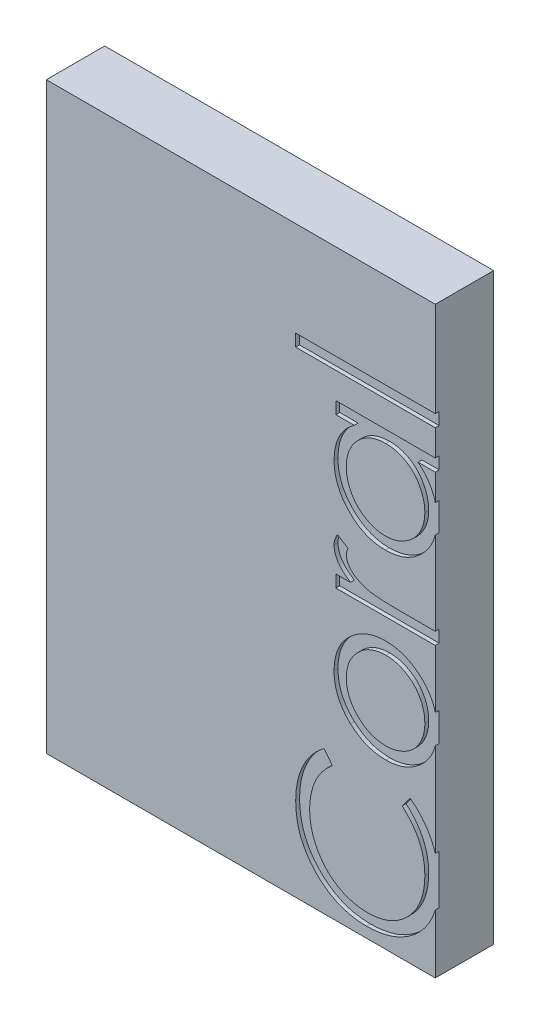
from build123d import *

# Parameters (mm, degrees)
SKETCH1_W           = 10
SKETCH1_H           = 15
BOSS_EXTRUDE1_DEPTH = 1.5
SKETCH2_W           = 3.58974359
SKETCH2_H           = 0.314102564
CUT_EXTRUDE1_DEPTH  = 0.1


with BuildPart() as part:
    # Sketch1 → Boss-Extrude1 (new body)
    with BuildSketch(Plane.XY):
        Rectangle(SKETCH1_W, SKETCH1_H)
    extrude(amount=BOSS_EXTRUDE1_DEPTH)

    # Sketch2 → Cut-Extrude1 (cut)
    # profile 1 of 5: a face of its own
    with BuildSketch(Plane.XY.offset(1.5)):
        with BuildLine():
            Line((2.142227564, -3.820512821), (2.352564103, -4.095352564))
            add(Edge.make_bspline(
                [(2.352564103, -4.095352564), (2.329198442, -4.114958654), (2.28278214, -4.1539065), (2.217598054, -4.216562748), (2.156549782, -4.281875441), (2.09924508, -4.349753703), (2.047987144, -4.421768395), (1.998783962, -4.495175554), (1.955704883, -4.572642388), (1.903078399, -4.679220252), (1.849360057, -4.819185909), (1.803157646, -4.994770751), (1.774023468, -5.17831657), (1.770846635, -5.303509384), (1.769230769, -5.3671875)],
                knots=[0, 0, 0, 0, 0.75789156, 1.505565099, 2.245254514, 2.979266606, 3.711207489, 4.440978832, 5.174393176, 5.91211879, 7.394186119, 8.890401545, 10.418332761, 12, 12, 12, 12], degree=3))
            add(Edge.make_bspline(
                [(1.769230769, -5.3671875), (1.769634732, -5.402270799), (1.770438908, -5.472111792), (1.781048033, -5.575760265), (1.795959243, -5.677473317), (1.818084566, -5.777184783), (1.846057184, -5.874767742), (1.879482602, -5.97086014), (1.920837429, -6.064070756), (1.966545735, -6.155688933), (2.018173011, -6.24346837), (2.074486973, -6.326522597), (2.134853847, -6.404553557), (2.199513113, -6.477605182), (2.268124966, -6.545817673), (2.341458086, -6.608332677), (2.418728518, -6.665985443), (2.500000431, -6.718447395), (2.584516904, -6.765675334), (2.672760474, -6.805386688), (2.763220234, -6.840070315), (2.856537478, -6.867946952), (2.952091972, -6.889840387), (3.050279572, -6.9049765), (3.150914118, -6.915462673), (3.219123313, -6.916263163), (3.253505609, -6.916666667)],
                knots=[0, 0, 0, 0, 1.054877232, 2.099964208, 3.13098259, 4.145888998, 5.169474743, 6.183358035, 7.203388855, 8.234598956, 9.261847606, 10.264062591, 11.251197969, 12.227332808, 13.196685059, 14.158975844, 15.123498106, 16.094582253, 17.066912473, 18.032714859, 19.002806091, 19.979168736, 20.95977404, 21.949109834, 22.966205168, 24, 24, 24, 24], degree=3))
            add(Edge.make_bspline(
                [(3.253505609, -6.916666667), (3.305235776, -6.915401889), (3.406801096, -6.912918666), (3.555588077, -6.890912333), (3.698262935, -6.857202942), (3.833859633, -6.807508901), (3.963508531, -6.74501076), (4.085637373, -6.667030312), (4.202035382, -6.576373468), (4.309883465, -6.472110203), (4.408395797, -6.357701362), (4.495146748, -6.234954252), (4.567461533, -6.104169752), (4.627637506, -5.966793179), (4.673894226, -5.821767049), (4.706458351, -5.669352251), (4.727700531, -5.509880255), (4.72973422, -5.400910855), (4.730769231, -5.345452724)],
                knots=[0, 0, 0, 0, 1.029159485, 2.020618137, 2.987588728, 3.942669054, 4.889339625, 5.846988364, 6.821327795, 7.821533711, 8.827683044, 9.822769455, 10.807800696, 11.797391277, 12.803701919, 13.832062008, 14.896664671, 16, 16, 16, 16], degree=3))
            add(Edge.make_bspline(
                [(4.730769231, -5.345452724), (4.729080451, -5.284350035), (4.725756528, -5.164085326), (4.697597279, -4.9877173), (4.651939362, -4.818881534), (4.588041439, -4.657568948), (4.504976151, -4.504234302), (4.404278274, -4.358637641), (4.284989941, -4.220656071), (4.193906813, -4.137684789), (4.147435897, -4.095352564)],
                knots=[0, 0, 0, 0, 1.028121516, 2.023589091, 2.998037872, 3.967518031, 4.937445131, 5.927275754, 6.942489185, 8, 8, 8, 8], degree=3))
            Line((4.147435897, -4.095352564), (4.355669071, -3.820512821))
            add(Edge.make_bspline(
                [(4.355669071, -3.820512821), (4.384206535, -3.842631706), (4.441144771, -3.886763529), (4.521431128, -3.958210043), (4.596880443, -4.03353031), (4.667115924, -4.112917932), (4.732428286, -4.196512836), (4.792853008, -4.28430735), (4.848069416, -4.376226533), (4.898788398, -4.471540283), (4.943444742, -4.57046823), (4.983016786, -4.672139468), (5.015778067, -4.777177388), (5.043490435, -4.884697801), (5.063250601, -4.99567177), (5.078986048, -5.108809306), (5.088321482, -5.225169334), (5.089265301, -5.303602625), (5.08974359, -5.343349359)],
                knots=[0, 0, 0, 0, 0.986911346, 1.969095443, 2.935967484, 3.900112155, 4.865124501, 5.834589912, 6.812044781, 7.795288262, 8.784678562, 9.777857908, 10.776141921, 11.791195789, 12.811324908, 13.855933174, 14.913475973, 16, 16, 16, 16], degree=3))
            add(Edge.make_bspline(
                [(5.08974359, -5.343349359), (5.089481597, -5.380993026), (5.088963539, -5.455428716), (5.080571372, -5.565327468), (5.069121635, -5.672317049), (5.051881504, -5.776091674), (5.031537164, -5.877217649), (5.004265907, -5.974778234), (4.973716741, -6.069733444), (4.937811754, -6.161701785), (4.897295571, -6.250761485), (4.851504013, -6.336625296), (4.800822148, -6.419253729), (4.746367137, -6.499459149), (4.686389836, -6.576056733), (4.621723201, -6.649710258), (4.55258519, -6.720832735), (4.502730337, -6.76483542), (4.477664263, -6.786959135)],
                knots=[0, 0, 0, 0, 1.114604814, 2.203992996, 3.262667896, 4.300477797, 5.318619304, 6.316056647, 7.298880507, 8.271930387, 9.238335007, 10.195173496, 11.151986948, 12.108099108, 13.064862484, 14.031167946, 15.010108607, 16, 16, 16, 16], degree=3))
            add(Edge.make_bspline(
                [(4.477664263, -6.786959135), (4.434122176, -6.822392467), (4.34756368, -6.892831349), (4.207290924, -6.982991062), (4.060964695, -7.059909976), (3.907737447, -7.122795993), (3.747549613, -7.171099791), (3.580658888, -7.205060501), (3.407398896, -7.226975295), (3.289563768, -7.229490657), (3.229667468, -7.230769231)],
                knots=[0, 0, 0, 0, 0.994611881, 1.977215934, 2.950189954, 3.921972279, 4.908960509, 5.911694611, 6.938501887, 8, 8, 8, 8], degree=3))
            add(Edge.make_bspline(
                [(3.229667468, -7.230769231), (3.166712014, -7.229214037), (3.04285109, -7.226154291), (2.861077137, -7.200158496), (2.686925738, -7.158339699), (2.520721993, -7.098942811), (2.361591713, -7.023637459), (2.210750508, -6.930610846), (2.067233708, -6.820943703), (1.933218957, -6.695496136), (1.810679604, -6.5579288), (1.702873401, -6.410609986), (1.613155885, -6.25382804), (1.538159722, -6.089310188), (1.480515259, -5.915824506), (1.440162072, -5.733741137), (1.415044956, -5.543402222), (1.411869748, -5.413539797), (1.41025641, -5.34755609)],
                knots=[0, 0, 0, 0, 1.032925535, 2.032216505, 3.007276963, 3.968222605, 4.92396291, 5.891752235, 6.871517503, 7.883894988, 8.900124299, 9.891468569, 10.874487609, 11.85992873, 12.854644235, 13.869047385, 14.917252991, 16, 16, 16, 16], degree=3))
            add(Edge.make_bspline(
                [(1.41025641, -5.34755609), (1.410738968, -5.30734175), (1.411694142, -5.227741513), (1.420994206, -5.109986949), (1.436530157, -4.995351652), (1.457564815, -4.883715059), (1.484053723, -4.774754421), (1.517067386, -4.668673587), (1.556372473, -4.56573232), (1.60125706, -4.465964064), (1.651729522, -4.37004231), (1.70719452, -4.278027274), (1.767371805, -4.190285797), (1.832877455, -4.107273921), (1.90316811, -4.028890082), (1.977420411, -3.95397153), (2.05753973, -3.88469907), (2.113946611, -3.841947403), (2.142227564, -3.820512821)],
                knots=[0, 0, 0, 0, 1.096622143, 2.170653093, 3.219033441, 4.250379162, 5.267604342, 6.275621678, 7.278284436, 8.271072515, 9.257558938, 10.232633088, 11.19973724, 12.157384997, 13.114417402, 14.069920322, 15.032307892, 16, 16, 16, 16], degree=3))
        make_face()
    # profile 2 of 5: a face of its own
    with BuildSketch(Plane.XY.offset(1.5)):
        with BuildLine():
            add(Edge.make_bspline(
                [(2.397435897, -1.95693109), (2.398457789, -1.908939817), (2.400461467, -1.814840659), (2.421876433, -1.677032773), (2.454623797, -1.545487638), (2.499895359, -1.419701445), (2.56057731, -1.30128515), (2.632986601, -1.188513906), (2.718769195, -1.081696897), (2.785127263, -1.017673868), (2.818810096, -0.985176282)],
                knots=[0, 0, 0, 0, 1.054011418, 2.066658804, 3.057071809, 4.030435133, 4.997543892, 5.974964718, 6.972108034, 8, 8, 8, 8], degree=3))
            add(Edge.make_bspline(
                [(2.818810096, -0.985176282), (2.851024082, -0.957194328), (2.914828624, -0.901771948), (3.018284237, -0.830706229), (3.125424338, -0.769484669), (3.237671664, -0.720421708), (3.354046336, -0.681736684), (3.474948347, -0.654270988), (3.600110694, -0.637934053), (3.685114532, -0.635731086), (3.728165064, -0.634615385)],
                knots=[0, 0, 0, 0, 1.025258237, 2.030674902, 3.01204498, 3.988269485, 4.97094183, 5.956517959, 6.965070386, 8, 8, 8, 8], degree=3))
            add(Edge.make_bspline(
                [(3.728165064, -0.634615385), (3.771465122, -0.635596722), (3.857028055, -0.63753589), (3.983047421, -0.655879507), (4.105242244, -0.684410593), (4.223100937, -0.725242431), (4.336983765, -0.77760054), (4.446393314, -0.841491227), (4.551545447, -0.917362845), (4.651547286, -1.003366841), (4.7437135, -1.098418718), (4.82404177, -1.201534866), (4.892863294, -1.3106889), (4.94829971, -1.427332253), (4.99200941, -1.55039974), (5.022709427, -1.680156808), (5.04127111, -1.816401878), (5.043654684, -1.9094291), (5.044871795, -1.95693109)],
                knots=[0, 0, 0, 0, 0.998656419, 1.973391657, 2.932242238, 3.890759089, 4.846373663, 5.82037756, 6.809684879, 7.83454468, 8.860553229, 9.859544525, 10.845671541, 11.83227036, 12.833544569, 13.85385346, 14.904124723, 16, 16, 16, 16], degree=3))
            add(Edge.make_bspline(
                [(5.044871795, -1.95693109), (5.043650599, -2.004665809), (5.041258824, -2.098156669), (5.022781541, -2.234882651), (4.992023559, -2.36487227), (4.948156066, -2.488100868), (4.892861522, -2.605245715), (4.824249833, -2.715032212), (4.743689678, -2.818232128), (4.651553741, -2.913304112), (4.551543784, -2.999302718), (4.446393746, -3.075175726), (4.336983652, -3.139066052), (4.223100967, -3.191424256), (4.105242236, -3.232256069), (3.983047423, -3.260787161), (3.857028055, -3.279130776), (3.771465122, -3.281069945), (3.728165064, -3.282051282)],
                knots=[0, 0, 0, 0, 1.099876186, 2.154163076, 3.173186993, 4.173200201, 5.163417411, 6.152872554, 7.150605724, 8.17532212, 9.198891216, 10.186952605, 11.159729845, 12.11414092, 13.071450619, 14.029093627, 15.002601286, 16, 16, 16, 16], degree=3))
            add(Edge.make_bspline(
                [(3.728165064, -3.282051282), (3.685347563, -3.28093064), (3.600576269, -3.278711963), (3.47566307, -3.262352733), (3.355131089, -3.235185885), (3.239391917, -3.195964576), (3.127414374, -3.146992691), (3.01988144, -3.086387299), (2.916877885, -3.014634138), (2.853157955, -2.959427073), (2.820913462, -2.931490385)],
                knots=[0, 0, 0, 0, 1.031377469, 2.041950136, 3.029500481, 4.003457997, 4.981637986, 5.969878303, 6.97268806, 8, 8, 8, 8], degree=3))
            add(Edge.make_bspline(
                [(2.820913462, -2.931490385), (2.786938522, -2.899041794), (2.720120826, -2.83522593), (2.634588302, -2.727877202), (2.560672228, -2.615383381), (2.501196013, -2.495658455), (2.454357495, -2.369975597), (2.42179198, -2.237756354), (2.400538625, -2.099480839), (2.398480447, -2.004921218), (2.397435897, -1.95693109)],
                knots=[0, 0, 0, 0, 1.027980169, 2.021703884, 2.998553061, 3.971491411, 4.943284454, 5.930300938, 6.949603206, 8, 8, 8, 8], degree=3))
        make_face()
        with BuildLine():
            add(Edge.make_bspline(
                [(2.711538462, -1.958333333), (2.712503053, -1.992270945), (2.714407336, -2.059270074), (2.728891241, -2.157889657), (2.751838743, -2.252829815), (2.784442806, -2.344270645), (2.826541681, -2.43190387), (2.878250132, -2.515813072), (2.938882737, -2.596246287), (3.00834677, -2.671625348), (3.084220713, -2.740818802), (3.165087316, -2.801256539), (3.249707869, -2.852937313), (3.33820971, -2.895209118), (3.430894599, -2.927628591), (3.52721671, -2.950601646), (3.627466904, -2.965112072), (3.695630015, -2.966992925), (3.730268429, -2.967948718)],
                knots=[0, 0, 0, 0, 1.02155314, 2.01673505, 2.994700672, 3.958461264, 4.934171024, 5.916582427, 6.921469794, 7.962398674, 8.998583302, 10.009097305, 10.997513862, 11.97957236, 12.956600784, 13.948243505, 14.957359924, 16, 16, 16, 16], degree=3))
            add(Edge.make_bspline(
                [(3.730268429, -2.967948718), (3.775020457, -2.966341894), (3.863844862, -2.96315265), (3.994655985, -2.937217413), (4.120237837, -2.893831134), (4.239854223, -2.835243854), (4.350526501, -2.761837635), (4.449197985, -2.675350568), (4.534383797, -2.576710868), (4.605064642, -2.467094368), (4.661224398, -2.34874005), (4.701023374, -2.223483729), (4.726895066, -2.092843035), (4.729466541, -2.003562304), (4.730769231, -1.958333333)],
                knots=[0, 0, 0, 0, 1.016792936, 2.018143844, 3.017858371, 4.030088057, 5.03801393, 6.028138512, 7.003788237, 7.991172063, 8.984598303, 9.972568034, 10.972917682, 12, 12, 12, 12], degree=3))
            add(Edge.make_bspline(
                [(4.730769231, -1.958333333), (4.729458951, -1.913106964), (4.726872494, -1.823831368), (4.701153674, -1.693372192), (4.661050013, -1.56845822), (4.605127803, -1.450226832), (4.534115389, -1.340660229), (4.449679012, -1.241311107), (4.35026516, -1.155562496), (4.239707631, -1.082228891), (4.120423279, -1.022682149), (3.994632807, -0.979498947), (3.863850765, -0.953501361), (3.775022434, -0.950320532), (3.730268429, -0.948717949)],
                knots=[0, 0, 0, 0, 1.02726834, 2.027799167, 3.010890988, 4.004497153, 4.992059811, 5.971914811, 6.958719428, 7.966827853, 8.981595046, 9.981490638, 10.983022906, 12, 12, 12, 12], degree=3))
            add(Edge.make_bspline(
                [(3.730268429, -0.948717949), (3.695629808, -0.949673411), (3.62746629, -0.951553616), (3.527219057, -0.966068762), (3.430886013, -0.98902439), (3.338241329, -1.021507944), (3.249478251, -1.063591981), (3.165335364, -1.116266258), (3.083940651, -1.176457142), (3.008592051, -1.246485402), (2.93885566, -1.321785787), (2.87822662, -1.402251596), (2.826768934, -1.486036376), (2.784082717, -1.573415011), (2.752135371, -1.664867564), (2.728758741, -1.759674697), (2.714468544, -1.857873506), (2.712521402, -1.92463255), (2.711538462, -1.958333333)],
                knots=[0, 0, 0, 0, 1.042975879, 2.052417305, 3.044379404, 4.0217225, 5.00409729, 5.996508862, 7.007348322, 8.048612455, 9.089876587, 10.095087598, 11.077815406, 12.047498138, 13.018202342, 13.98964644, 14.985148868, 16, 16, 16, 16], degree=3))
        make_face(mode=Mode.SUBTRACT)
    # profile 3 of 5: a face of its own
    with BuildSketch(Plane.XY.offset(1.5)):
        with BuildLine():
            Line((2.442307692, -0.096153846), (2.442307692, 0.217948718))
            Line((2.442307692, 0.217948718), (2.818810096, 0.217948718))
            add(Edge.make_bspline(
                [(2.818810096, 0.217948718), (2.783738574, 0.24112264), (2.716664561, 0.285442584), (2.628073942, 0.359452402), (2.553886788, 0.434451976), (2.495517859, 0.512410658), (2.451405202, 0.592564123), (2.42040862, 0.67423648), (2.401186696, 0.757627447), (2.398687838, 0.813802909), (2.397435897, 0.841947115)],
                knots=[0, 0, 0, 0, 1.280091057, 2.448164201, 3.510831157, 4.48793739, 5.405868014, 6.289422536, 7.142991551, 8, 8, 8, 8], degree=3))
            add(Edge.make_bspline(
                [(2.397435897, 0.841947115), (2.398626424, 0.863773442), (2.40107601, 0.908682527), (2.418286835, 0.976665117), (2.445764857, 1.046708569), (2.47160508, 1.091850956), (2.485076122, 1.115384615)],
                knots=[0, 0, 0, 0, 0.901110191, 1.854092781, 2.881294221, 4, 4, 4, 4], degree=3))
            Line((2.485076122, 1.115384615), (2.757111378, 0.942908654))
            add(Edge.make_bspline(
                [(2.757111378, 0.942908654), (2.750371112, 0.927799633), (2.737576797, 0.899119818), (2.722434787, 0.857165252), (2.713518871, 0.818483915), (2.712168153, 0.793840357), (2.711538462, 0.782351763)],
                knots=[0, 0, 0, 0, 1.180555205, 2.24091978, 3.179933427, 4, 4, 4, 4], degree=3))
            add(Edge.make_bspline(
                [(2.711538462, 0.782351763), (2.713205342, 0.757138462), (2.716605295, 0.705710636), (2.743715961, 0.630459302), (2.786258779, 0.556783927), (2.834702472, 0.498835693), (2.881236875, 0.453808829), (2.921964739, 0.421426651), (2.968055544, 0.392363163), (3.017727776, 0.364170809), (3.072228068, 0.337977984), (3.131645329, 0.314570846), (3.195488916, 0.292680666), (3.23988085, 0.280353126), (3.262620192, 0.274038462)],
                knots=[0, 0, 0, 0, 1.125322384, 2.295331465, 3.535939348, 4.916963136, 5.656144286, 6.429838446, 7.238666481, 8.090384391, 8.983239461, 9.940052224, 10.944811494, 12, 12, 12, 12], degree=3))
            add(Edge.make_bspline(
                [(3.262620192, 0.274038462), (3.282896243, 0.269297889), (3.328031366, 0.258745228), (3.403408766, 0.248758835), (3.492407393, 0.238494452), (3.595130637, 0.231484911), (3.711973369, 0.224863465), (3.842431528, 0.221205506), (3.986863682, 0.218065101), (4.087604542, 0.21798875), (4.140424679, 0.217948718)],
                knots=[0, 0, 0, 0, 0.566841273, 1.261806378, 2.068780918, 3.007109044, 4.065315289, 5.256255371, 6.561408263, 8, 8, 8, 8], degree=3))
            Line((4.140424679, 0.217948718), (5, 0.217948718))
            Line((5, 0.217948718), (5, -0.096153846))
            Line((5, -0.096153846), (2.442307692, -0.096153846))
        make_face()
    # profile 4 of 5: a face of its own
    with BuildSketch(Plane.XY.offset(1.5)):
        with BuildLine():
            Line((2.442307692, 4.076923077), (5, 4.076923077))
            Line((5, 4.076923077), (5, 3.762820513))
            Line((5, 3.762820513), (4.557592147, 3.762820513))
            add(Edge.make_bspline(
                [(4.557592147, 3.762820513), (4.597565767, 3.727346428), (4.675690796, 3.658015355), (4.77869158, 3.543310539), (4.862093948, 3.420211967), (4.930432084, 3.291808546), (4.981557966, 3.156842531), (5.017961997, 3.016019346), (5.041350966, 2.869204451), (5.043687656, 2.768952579), (5.044871795, 2.718149038)],
                knots=[0, 0, 0, 0, 1.074325654, 2.099677833, 3.090439787, 4.057542011, 5.018572219, 5.985274637, 6.979019747, 8, 8, 8, 8], degree=3))
            add(Edge.make_bspline(
                [(5.044871795, 2.718149038), (5.043645423, 2.672981085), (5.041226962, 2.58390788), (5.022464659, 2.452878803), (4.992334037, 2.326786553), (4.950433147, 2.20551198), (4.894852326, 2.089839835), (4.828311078, 1.978779738), (4.749070248, 1.872907046), (4.658482219, 1.773835507), (4.560087232, 1.682603507), (4.455141685, 1.602542234), (4.344099381, 1.535789155), (4.228366227, 1.479969074), (4.107051308, 1.436972729), (3.98057414, 1.406999095), (3.849084266, 1.388258648), (3.759544743, 1.385841188), (3.714142628, 1.384615385)],
                knots=[0, 0, 0, 0, 1.033919861, 2.038935746, 3.024066025, 3.998881131, 4.97069526, 5.957263378, 6.95902576, 7.993208707, 9.027059324, 10.027763471, 11.009749337, 11.988697705, 12.965288445, 13.950418724, 14.960734635, 16, 16, 16, 16], degree=3))
            add(Edge.make_bspline(
                [(3.714142628, 1.384615385), (3.669678925, 1.385868356), (3.581776581, 1.388345413), (3.452497883, 1.406798633), (3.327979623, 1.437829641), (3.208622679, 1.481377489), (3.094282629, 1.537219444), (2.984878604, 1.605147531), (2.880109207, 1.685166656), (2.78243798, 1.777419063), (2.692217366, 1.877353833), (2.61380832, 1.984262564), (2.546091471, 2.095485845), (2.492437995, 2.212748856), (2.449028891, 2.33431596), (2.418995922, 2.461269406), (2.401298601, 2.593080985), (2.398735837, 2.682571477), (2.397435897, 2.727964744)],
                knots=[0, 0, 0, 0, 1.020392517, 2.01726096, 2.990465484, 3.961182959, 4.928053699, 5.906110375, 6.912531644, 7.948652711, 8.985773172, 9.998621852, 10.987621588, 11.969261332, 12.953316658, 13.946091881, 14.958173133, 16, 16, 16, 16], degree=3))
            add(Edge.make_bspline(
                [(2.397435897, 2.727964744), (2.39887525, 2.780163614), (2.401697754, 2.882523135), (2.425137839, 3.032265123), (2.464858882, 3.173858623), (2.518517159, 3.308806786), (2.591313467, 3.435252087), (2.680573659, 3.554768581), (2.789988065, 3.664813547), (2.872981854, 3.729586395), (2.915564904, 3.762820513)],
                knots=[0, 0, 0, 0, 1.039007978, 2.037445607, 3.008437381, 3.96246474, 4.921201921, 5.904967172, 6.925065498, 8, 8, 8, 8], degree=3))
            Line((2.915564904, 3.762820513), (2.442307692, 3.762820513))
            Line((2.442307692, 3.762820513), (2.442307692, 4.076923077))
        make_face()
        with BuildLine():
            add(Edge.make_bspline(
                [(2.711538462, 2.732171474), (2.713173497, 2.686258125), (2.716400798, 2.595632475), (2.741554074, 2.462574183), (2.783514648, 2.335314466), (2.840564965, 2.214051215), (2.913662704, 2.102165932), (2.999785337, 2.000416495), (3.100386581, 1.911940236), (3.211866206, 1.835850867), (3.332038502, 1.77476812), (3.457619423, 1.731543851), (3.586435635, 1.70308938), (3.673796821, 1.700178887), (3.717648237, 1.698717949)],
                knots=[0, 0, 0, 0, 1.031130969, 2.035288524, 3.029955243, 4.035265425, 5.037320146, 6.024362013, 7.021230137, 8.037832003, 9.049975902, 10.039737725, 11.016035826, 12, 12, 12, 12], degree=3))
            add(Edge.make_bspline(
                [(3.717648237, 1.698717949), (3.761235591, 1.700590368), (3.848239452, 1.704327867), (3.977044607, 1.730920862), (4.102343635, 1.776120385), (4.223481619, 1.837120536), (4.336050525, 1.914105418), (4.438458683, 2.00249753), (4.525928464, 2.10473651), (4.599202423, 2.217622119), (4.658355194, 2.338241316), (4.699523393, 2.465072301), (4.726100502, 2.595748712), (4.72920507, 2.684600942), (4.730769231, 2.729366987)],
                knots=[0, 0, 0, 0, 0.979154007, 1.954470061, 2.941101473, 3.965068436, 4.993389179, 5.998216918, 6.996159742, 8.005560442, 9.015493761, 10.005250788, 10.994993882, 12, 12, 12, 12], degree=3))
            add(Edge.make_bspline(
                [(4.730769231, 2.729366987), (4.72909009, 2.774807298), (4.725750446, 2.865183568), (4.700739479, 2.998785195), (4.657850173, 3.127995158), (4.600211381, 3.251932038), (4.528420783, 3.367276812), (4.444373386, 3.470449438), (4.347299039, 3.55872156), (4.239373761, 3.632214561), (4.121809783, 3.690498101), (3.99677049, 3.733114281), (3.864002081, 3.75803083), (3.773141777, 3.761201876), (3.726762821, 3.762820513)],
                knots=[0, 0, 0, 0, 1.01787422, 2.024450869, 3.03297362, 4.061474925, 5.080076323, 6.069755756, 7.033548292, 8.009625779, 8.9862229, 9.964937832, 10.961217871, 12, 12, 12, 12], degree=3))
            add(Edge.make_bspline(
                [(3.726762821, 3.762820513), (3.69142499, 3.761860856), (3.621868957, 3.759971949), (3.519741439, 3.745541379), (3.422007713, 3.722586453), (3.328565024, 3.690240283), (3.239930009, 3.647748999), (3.155466248, 3.596501233), (3.075613037, 3.535595783), (3.001469966, 3.466013087), (2.933843504, 3.389847884), (2.873479263, 3.309253344), (2.82389049, 3.223274597), (2.782849219, 3.13335756), (2.750190069, 3.039346225), (2.728402375, 2.940475606), (2.713442054, 2.837796619), (2.712179673, 2.767750563), (2.711538462, 2.732171474)],
                knots=[0, 0, 0, 0, 1.050140795, 2.067009409, 3.05949893, 4.030605086, 5.00011959, 5.97591094, 6.962425594, 7.979863591, 8.993523472, 9.986985069, 10.967611495, 11.937549037, 12.921786183, 13.919465291, 14.943216303, 16, 16, 16, 16], degree=3))
        make_face(mode=Mode.SUBTRACT)
    # profile 5 of 5: a face of its own
    with BuildSketch(Plane.XY.offset(1.5)):
        with Locations((3.205128205, 4.907051282)):
            Rectangle(SKETCH2_W, SKETCH2_H)
    extrude(amount=-CUT_EXTRUDE1_DEPTH, mode=Mode.SUBTRACT)


solid = part.part
